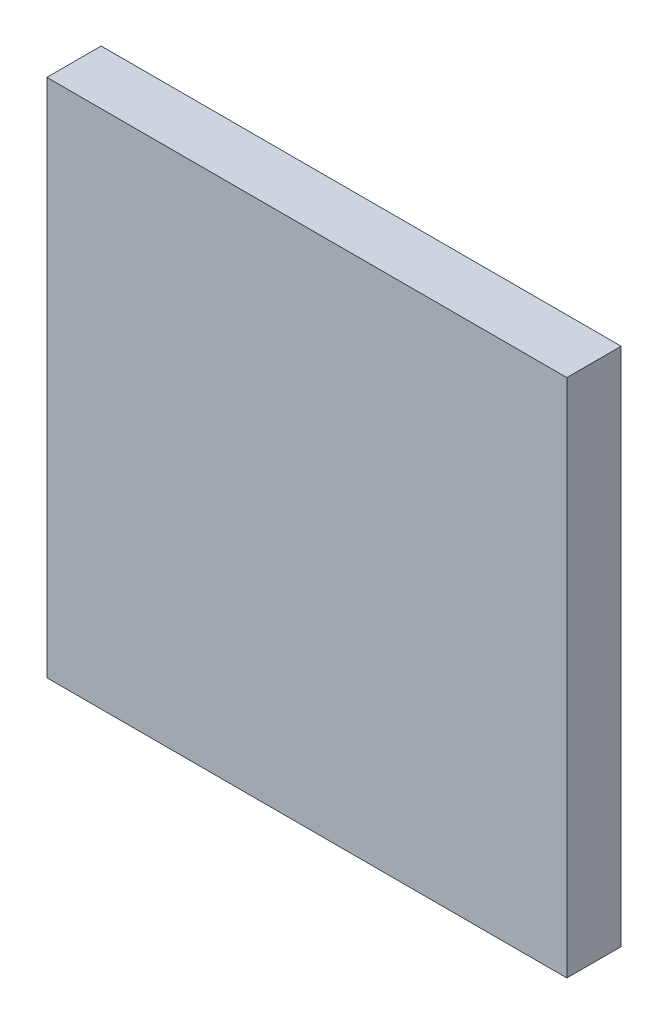
from build123d import *

# Parameters (mm, degrees)
SKETCH1_W           = 9
SKETCH1_H           = 9
BOSS_EXTRUDE1_DEPTH = 0.9398


with BuildPart() as part:
    # Sketch1 → Boss-Extrude1 (new body)
    with BuildSketch(Plane.XY):
        Rectangle(SKETCH1_W, SKETCH1_H)
    extrude(amount=BOSS_EXTRUDE1_DEPTH)


solid = part.part
